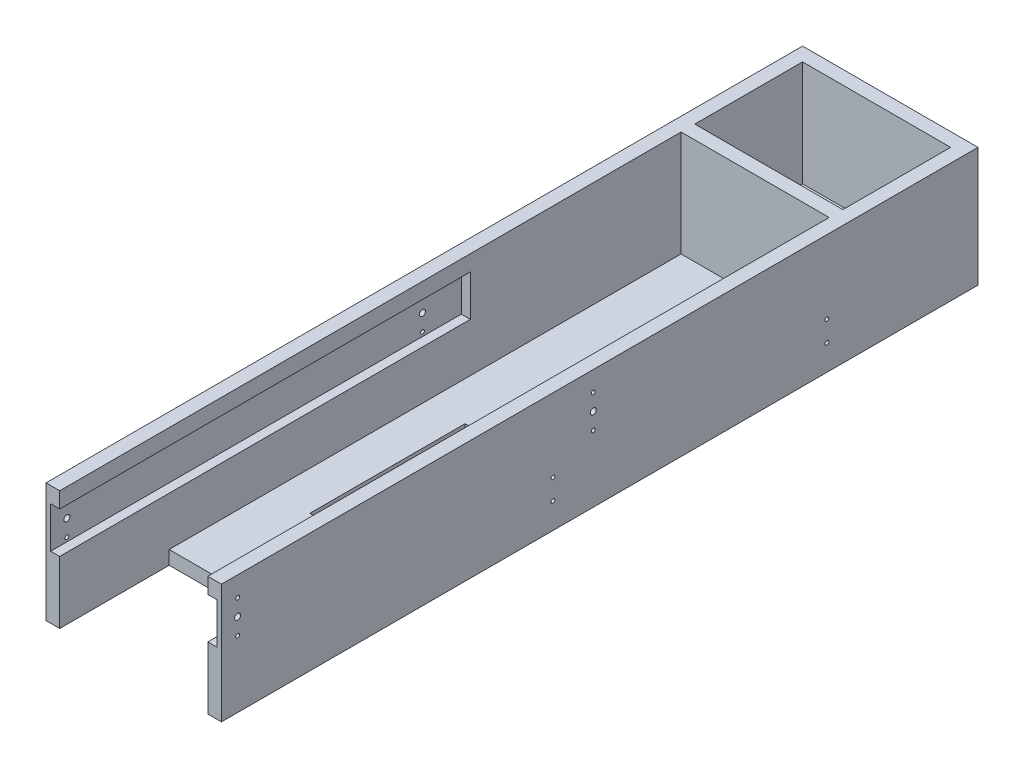
from build123d import *

# Parameters (mm, degrees)
BOSS_EXTRUDE1_DEPTH            = 294.64
SKETCH3_W                      = 68.7
SKETCH3_H                      = 6.35
BOSS_EXTRUDE2_DEPTH            = 48
CUT_EXTRUDE2_REACH             = 304.363
SKETCH4_R                      = 1.3890625
SKETCH4_R_2                    = 11
SKETCH4_W                      = 26
SKETCH4_H                      = 72
CUT_EXTRUDE3_REACH             = 303.286
SKETCH5_R                      = 1.7859375
CUT_EXTRUDE4_REACH             = 309.814
SKETCH6_R                      = 1.3890625
CUT_EXTRUDE4_DIRECTION_2_REACH = 309.814
CUT_EXTRUDE5_REACH             = 309.814
SKETCH11_R                     = 0.889
SKETCH12_W                     = 68.7
SKETCH12_H                     = 6.35
CUT_EXTRUDE6_DEPTH             = 50.8
BOSS_EXTRUDE3_DEPTH            = 50
SKETCH14_W                     = 81.4
SKETCH14_H                     = 54.35
BOSS_EXTRUDE4_DEPTH            = 6.35
SKETCH15_W                     = 68.7
SKETCH15_H                     = 50
BOSS_EXTRUDE5_DEPTH            = 1
SKETCH16_W                     = 190.5
SKETCH16_H                     = 19.05
CUT_EXTRUDE7_DEPTH             = 4.175
SKETCH17_W                     = 190.5
SKETCH17_H                     = 19.05
CUT_EXTRUDE8_DEPTH             = 4.175
CUT_EXTRUDE9_DEPTH             = 310.015097083
CUT_EXTRUDE9_DEPTH_BACK        = 310.015097083
SKETCH18_R                     = 0.889


with BuildPart() as part:
    # Sketch1 → Boss-Extrude1 (new body)
    with BuildSketch(Plane.XY):
        Polygon((0, 0), (34.35, 0), (34.35, 48), (40.7, 48), (40.7, -6.35), (0, -6.35), align=None)
    extrude(amount=BOSS_EXTRUDE1_DEPTH)

    # Mirror1: part across plane


with BuildPart() as part_1:
    add(part.part)
    add(part.part.mirror(Plane(origin=(0, -6.35, 294.64), x_dir=(0, 0, 1), z_dir=(1, 0, 0))))

    # Sketch3 → Boss-Extrude2 (add)
    with BuildSketch(Plane(origin=(0, 0, 0), x_dir=(1, 0, 0), z_dir=(0, 1, 0))):
        with Locations((0, -3.175)):
            Rectangle(SKETCH3_W, SKETCH3_H)
    extrude(amount=BOSS_EXTRUDE2_DEPTH)

    # Sketch4 → Cut-Extrude2 (cut, up to next)
    with BuildSketch(Plane.XZ.offset(6.35), mode=Mode.PRIVATE) as cut_extrude2_sk1:
        with Locations((0, 12.7)):
            Circle(SKETCH4_R)
    cut_extrude2_tool1 = extrude(cut_extrude2_sk1.sketch, amount=-CUT_EXTRUDE2_REACH, mode=Mode.PRIVATE) & part_1.part
    # Sketch4 → Cut-Extrude2 (cut, up to next)
    with BuildSketch(Plane.XZ.offset(6.35), mode=Mode.PRIVATE) as cut_extrude2_sk2:
        with Locations((0, 95.2)):
            Circle(SKETCH4_R)
    cut_extrude2_tool2 = extrude(cut_extrude2_sk2.sketch, amount=-CUT_EXTRUDE2_REACH, mode=Mode.PRIVATE) & part_1.part
    # Sketch4 → Cut-Extrude2 (cut, up to next)
    with BuildSketch(Plane.XZ.offset(6.35), mode=Mode.PRIVATE) as cut_extrude2_sk3:
        with Locations((0, 53.95)):
            Circle(SKETCH4_R_2)
    cut_extrude2_tool3 = extrude(cut_extrude2_sk3.sketch, amount=-CUT_EXTRUDE2_REACH, mode=Mode.PRIVATE) & part_1.part
    # Sketch4 → Cut-Extrude2 (cut, up to next)
    with BuildSketch(Plane.XZ.offset(6.35), mode=Mode.PRIVATE) as cut_extrude2_sk4:
        with Locations((-3.2622, 160.64)):
            Rectangle(SKETCH4_W, SKETCH4_H)
    cut_extrude2_tool4 = extrude(cut_extrude2_sk4.sketch, amount=-CUT_EXTRUDE2_REACH, mode=Mode.PRIVATE) & part_1.part
    add(cut_extrude2_tool1.solids().sort_by_distance((0, -6.35, 12.7))[0], mode=Mode.SUBTRACT)
    add(cut_extrude2_tool2.solids().sort_by_distance((0, -6.35, 95.2))[0], mode=Mode.SUBTRACT)
    add(cut_extrude2_tool3.solids().sort_by_distance((0, -6.35, 53.95))[0], mode=Mode.SUBTRACT)
    add(cut_extrude2_tool4.solids().sort_by_distance((-3.2622, -6.35, 160.64))[0], mode=Mode.SUBTRACT)

    # Sketch5 → Cut-Extrude3 (cut, up to next)
    with BuildSketch(Plane(origin=(0, 0, 0), x_dir=(1, 0, 0), z_dir=(0, 1, 0)), mode=Mode.PRIVATE) as cut_extrude3_sk1:
        with Locations(Location((16.0628, -195.74, 0), (0, 0, 270))):
            Circle(SKETCH5_R)
    cut_extrude3_tool1 = extrude(cut_extrude3_sk1.sketch, amount=-CUT_EXTRUDE3_REACH, mode=Mode.PRIVATE) & part_1.part
    # Sketch5 → Cut-Extrude3 (cut, up to next)
    with BuildSketch(Plane(origin=(0, 0, 0), x_dir=(1, 0, 0), z_dir=(0, 1, 0)), mode=Mode.PRIVATE) as cut_extrude3_sk2:
        with Locations(Location((16.0628, -139.74, 0), (0, 0, 270))):
            Circle(SKETCH5_R)
    cut_extrude3_tool2 = extrude(cut_extrude3_sk2.sketch, amount=-CUT_EXTRUDE3_REACH, mode=Mode.PRIVATE) & part_1.part
    add(cut_extrude3_tool1.solids().sort_by_distance((16.0628, 0, 195.74))[0], mode=Mode.SUBTRACT)
    add(cut_extrude3_tool2.solids().sort_by_distance((16.0628, 0, 139.74))[0], mode=Mode.SUBTRACT)

    # Cut-Extrude4: up to this face of the body (flat: up to its plane)
    cut_extrude4_end = Plane(part_1.part.faces().sort_by_distance((40.7, 20.825, 147.32))[0])
    # Sketch6 → Cut-Extrude4 (cut, up to the picked face)
    with BuildSketch(Plane(origin=(-34.35, 0, 0), x_dir=(0, 0, -1), z_dir=(1, 0, 0)), mode=Mode.PRIVATE) as cut_extrude4_sk1:
        with Locations(Location((-287.14, 32.15, 0), (0, 0, 180))):
            Circle(SKETCH6_R)
    cut_extrude4_tool1 = split(extrude(cut_extrude4_sk1.sketch, amount=CUT_EXTRUDE4_REACH, mode=Mode.PRIVATE), bisect_by=cut_extrude4_end, keep=Keep.BOTH, mode=Mode.PRIVATE)
    # Sketch6 → Cut-Extrude4 (cut, up to the picked face)
    with BuildSketch(Plane(origin=(-34.35, 0, 0), x_dir=(0, 0, -1), z_dir=(1, 0, 0)), mode=Mode.PRIVATE) as cut_extrude4_sk2:
        with Locations(Location((-122.14, 32.15, 0), (0, 0, 180))):
            Circle(SKETCH6_R)
    cut_extrude4_tool2 = split(extrude(cut_extrude4_sk2.sketch, amount=CUT_EXTRUDE4_REACH, mode=Mode.PRIVATE), bisect_by=cut_extrude4_end, keep=Keep.BOTH, mode=Mode.PRIVATE)
    add(cut_extrude4_tool1.solids().sort_by(Axis((-34.35, 32.15, 287.14), (1, 0, 0)))[0], mode=Mode.SUBTRACT)
    add(cut_extrude4_tool2.solids().sort_by(Axis((-34.35, 32.15, 122.14), (1, 0, 0)))[0], mode=Mode.SUBTRACT)

    # Cut-Extrude4 direction 2: up to this face of the body (flat: up to its plane)
    cut_extrude4_direction_2_end = Plane(part_1.part.faces().sort_by_distance((-40.7, 20.825, 147.32))[0])
    # Sketch6 → Cut-Extrude4 direction 2 (cut, up to the picked face)
    with BuildSketch(Plane(origin=(-34.35, 0, 0), x_dir=(0, 0, -1), z_dir=(1, 0, 0)), mode=Mode.PRIVATE) as cut_extrude4_direction_2_sk1:
        with Locations(Location((-287.14, 32.15, 0), (0, 0, 180))):
            Circle(SKETCH6_R)
    cut_extrude4_direction_2_tool1 = split(extrude(cut_extrude4_direction_2_sk1.sketch, amount=-CUT_EXTRUDE4_DIRECTION_2_REACH, mode=Mode.PRIVATE), bisect_by=cut_extrude4_direction_2_end, keep=Keep.BOTH, mode=Mode.PRIVATE)
    # Sketch6 → Cut-Extrude4 direction 2 (cut, up to the picked face)
    with BuildSketch(Plane(origin=(-34.35, 0, 0), x_dir=(0, 0, -1), z_dir=(1, 0, 0)), mode=Mode.PRIVATE) as cut_extrude4_direction_2_sk2:
        with Locations(Location((-122.14, 32.15, 0), (0, 0, 180))):
            Circle(SKETCH6_R)
    cut_extrude4_direction_2_tool2 = split(extrude(cut_extrude4_direction_2_sk2.sketch, amount=-CUT_EXTRUDE4_DIRECTION_2_REACH, mode=Mode.PRIVATE), bisect_by=cut_extrude4_direction_2_end, keep=Keep.BOTH, mode=Mode.PRIVATE)
    add(cut_extrude4_direction_2_tool1.solids().sort_by(Axis((-34.35, 32.15, 287.14), (-1, 0, 0)))[0], mode=Mode.SUBTRACT)
    add(cut_extrude4_direction_2_tool2.solids().sort_by(Axis((-34.35, 32.15, 122.14), (-1, 0, 0)))[0], mode=Mode.SUBTRACT)

    # Sketch11 → Cut-Extrude5 (cut, up to next)
    with BuildSketch(Plane.ZY.offset(-34.35), mode=Mode.PRIVATE) as cut_extrude5_sk1:
        with Locations((13.75, 5.5)):
            Circle(SKETCH11_R)
    cut_extrude5_tool1 = extrude(cut_extrude5_sk1.sketch, amount=-CUT_EXTRUDE5_REACH, mode=Mode.PRIVATE) & part_1.part
    # Sketch11 → Cut-Extrude5 (cut, up to next)
    with BuildSketch(Plane.ZY.offset(-34.35), mode=Mode.PRIVATE) as cut_extrude5_sk2:
        with Locations((13.75, 15)):
            Circle(SKETCH11_R)
    cut_extrude5_tool2 = extrude(cut_extrude5_sk2.sketch, amount=-CUT_EXTRUDE5_REACH, mode=Mode.PRIVATE) & part_1.part
    # Sketch11 → Cut-Extrude5 (cut, up to next)
    with BuildSketch(Plane.ZY.offset(-34.35), mode=Mode.PRIVATE) as cut_extrude5_sk3:
        with Locations((140.81, 15)):
            Circle(SKETCH11_R)
    cut_extrude5_tool3 = extrude(cut_extrude5_sk3.sketch, amount=-CUT_EXTRUDE5_REACH, mode=Mode.PRIVATE) & part_1.part
    # Sketch11 → Cut-Extrude5 (cut, up to next)
    with BuildSketch(Plane.ZY.offset(-34.35), mode=Mode.PRIVATE) as cut_extrude5_sk4:
        with Locations((140.81, 5.5)):
            Circle(SKETCH11_R)
    cut_extrude5_tool4 = extrude(cut_extrude5_sk4.sketch, amount=-CUT_EXTRUDE5_REACH, mode=Mode.PRIVATE) & part_1.part
    add(cut_extrude5_tool1.solids().sort_by_distance((34.35, 5.5, 13.75))[0], mode=Mode.SUBTRACT)
    add(cut_extrude5_tool2.solids().sort_by_distance((34.35, 15, 13.75))[0], mode=Mode.SUBTRACT)
    add(cut_extrude5_tool3.solids().sort_by_distance((34.35, 15, 140.81))[0], mode=Mode.SUBTRACT)
    add(cut_extrude5_tool4.solids().sort_by_distance((34.35, 5.5, 140.81))[0], mode=Mode.SUBTRACT)

    # Sketch12 → Cut-Extrude6 (cut)
    with BuildSketch(Plane.XY.offset(294.64)):
        with Locations((0, -3.175)):
            Rectangle(SKETCH12_W, SKETCH12_H)
    extrude(amount=-CUT_EXTRUDE6_DEPTH, mode=Mode.SUBTRACT)

    # Sketch13 → Boss-Extrude3 (add)
    with BuildSketch(Plane(origin=(0, 0, 0), x_dir=(-1, 0, 0), z_dir=(0, 0, -1))):
        Polygon((34.35, 48), (34.35, 0), (-34.35, 0), (-34.35, 48), (-40.7, 48), (-40.7, -6.35), (40.7, -6.35), (40.7, 48), align=None)
    extrude(amount=BOSS_EXTRUDE3_DEPTH)

    # Sketch14 → Boss-Extrude4 (add)
    with BuildSketch(Plane(origin=(0, 0, -50), x_dir=(-1, 0, 0), z_dir=(0, 0, -1))):
        with Locations((0, 20.825)):
            Rectangle(SKETCH14_W, SKETCH14_H)
    extrude(amount=BOSS_EXTRUDE4_DEPTH)

    # Sketch15 → Boss-Extrude5 (add)
    with BuildSketch(Plane(origin=(0, 48, 0), x_dir=(1, 0, 0), z_dir=(0, 1, 0))):
        Polygon((40.7, -294.64), (40.7, 56.35), (-40.7, 56.35), (-40.7, -294.64), (-34.35, -294.64), (-34.35, -6.35), (34.35, -6.35), (34.35, -294.64), align=None)
        with Locations((0, 25)):
            Rectangle(SKETCH15_W, SKETCH15_H, mode=Mode.SUBTRACT)
    extrude(amount=BOSS_EXTRUDE5_DEPTH)

    # Sketch16 → Cut-Extrude7 (cut)
    with BuildSketch(Plane(origin=(-34.35, 0, 0), x_dir=(0, 0, -1), z_dir=(1, 0, 0))):
        with Locations((-199.39, 32.15)):
            Rectangle(SKETCH16_W, SKETCH16_H)
    extrude(amount=-CUT_EXTRUDE7_DEPTH, mode=Mode.SUBTRACT)

    # Sketch17 → Cut-Extrude8 (cut)
    with BuildSketch(Plane.ZY.offset(-34.35)):
        with Locations((199.39, 32.15)):
            Rectangle(SKETCH17_W, SKETCH17_H)
    extrude(amount=-CUT_EXTRUDE8_DEPTH, mode=Mode.SUBTRACT)

    # Sketch18 → Cut-Extrude9 (cut, two sides: drawn at the far end of the back side and taken through both)
    with BuildSketch(Plane(origin=(-38.525, 0, 0), x_dir=(0, 0, -1), z_dir=(1, 0, 0)).offset(-CUT_EXTRUDE9_DEPTH_BACK)):
        with Locations((-287.14, 39.77)):
            Circle(SKETCH18_R)
        with Locations((-287.14, 24.53)):
            Circle(SKETCH18_R)
        with Locations((-122.14, 39.77)):
            Circle(SKETCH18_R)
        with Locations((-122.14, 24.53)):
            Circle(SKETCH18_R)
    extrude(amount=CUT_EXTRUDE9_DEPTH + CUT_EXTRUDE9_DEPTH_BACK, mode=Mode.SUBTRACT)


solid = part_1.part
